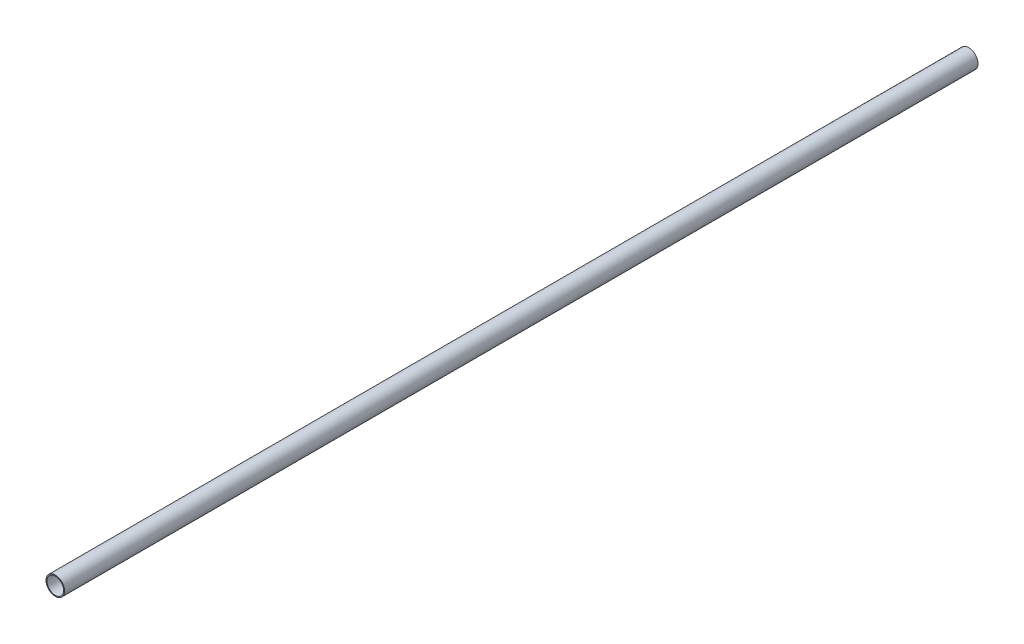
from build123d import *

# Parameters (mm, degrees)
SKETCH_1_R      = 5
SKETCH_1_R_2    = 4.5
EXTRUDE_1_DEPTH = 492


with BuildPart() as part:
    # Эскиз1 → Бобышка-Вытянуть1 (new body)
    with BuildSketch(Plane.XY):
        Circle(SKETCH_1_R)
        Circle(SKETCH_1_R_2, mode=Mode.SUBTRACT)
    extrude(amount=EXTRUDE_1_DEPTH)


solid = part.part
